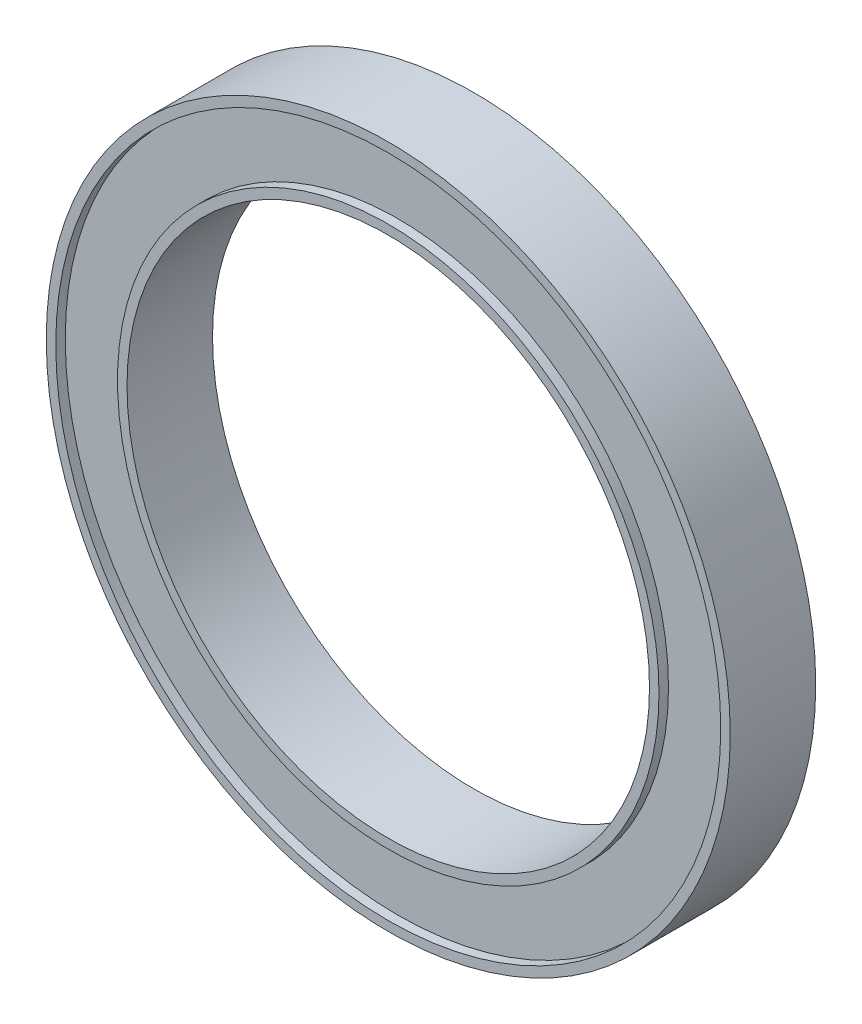
from build123d import *

# Parameters (mm, degrees)
SKETCH1_R           = 36
SKETCH1_R_2         = 27.5
BOSS_EXTRUDE1_DEPTH = 4.5
SKETCH3_R           = 35
SKETCH3_R_2         = 28.5
CUT_EXTRUDE1_DEPTH  = 1


with BuildPart() as part:
    # Sketch1 → Boss-Extrude1 (new, symmetric)
    with BuildSketch(Plane.XY):
        Circle(SKETCH1_R)
        Circle(SKETCH1_R_2, mode=Mode.SUBTRACT)
    extrude(amount=BOSS_EXTRUDE1_DEPTH, both=True)

    # Sketch3 → Cut-Extrude1 (cut)
    with BuildSketch(Plane.XY.offset(4.5)):
        Circle(SKETCH3_R)
        Circle(SKETCH3_R_2, mode=Mode.SUBTRACT)
    cut_extrude1 = extrude(amount=-CUT_EXTRUDE1_DEPTH, mode=Mode.SUBTRACT)

    # Mirror1: Cut-Extrude1 across plane
    add(cut_extrude1.mirror(Plane.XY), mode=Mode.SUBTRACT)


solid = part.part
